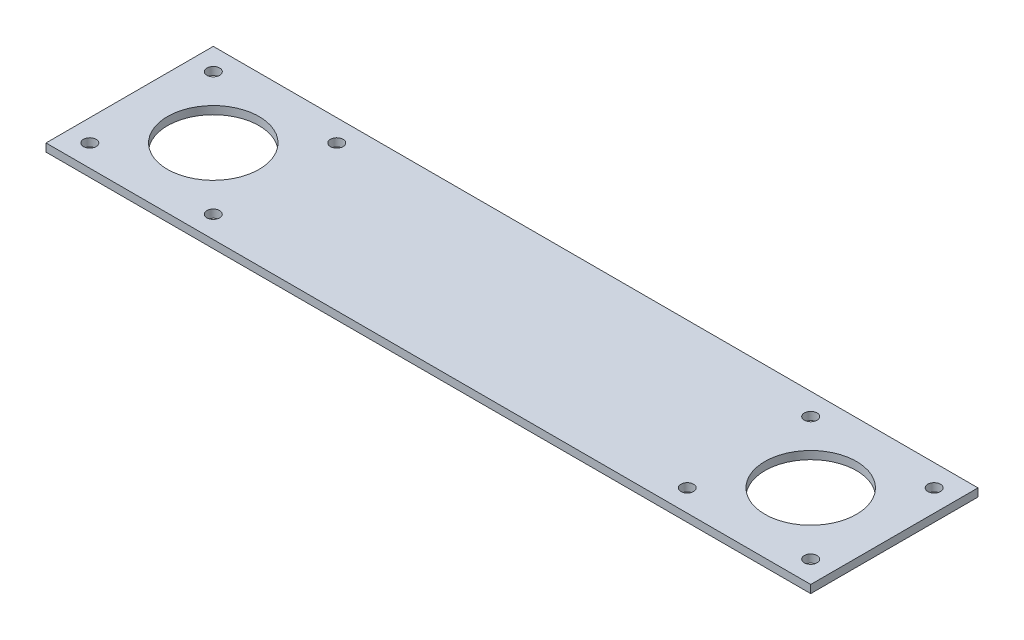
from build123d import *

# Parameters (mm, degrees)
SKETCH1_W           = 192
SKETCH1_H           = 42
SKETCH1_R           = 1.6
SKETCH1_R_2         = 11.5
BOSS_EXTRUDE1_DEPTH = 2


with BuildPart() as part:
    # Sketch1 → Boss-Extrude1 (new body)
    with BuildSketch(Plane(origin=(0, 0, 0), x_dir=(1, 0, 0), z_dir=(0, 1, 0))):
        Rectangle(SKETCH1_W, SKETCH1_H)
        with Locations(Location((-90.5, -15.5, 0), (0, 0, 270))):
            Circle(SKETCH1_R, mode=Mode.SUBTRACT)
        with Locations(Location((-59.5, -15.5, 0), (0, 0, 270))):
            Circle(SKETCH1_R, mode=Mode.SUBTRACT)
        with Locations(Location((59.5, -15.5, 0), (0, 0, 270))):
            Circle(SKETCH1_R, mode=Mode.SUBTRACT)
        with Locations(Location((90.5, -15.5, 0), (0, 0, 270))):
            Circle(SKETCH1_R, mode=Mode.SUBTRACT)
        with Locations(Location((-75, 0, 0), (0, 0, 270))):
            Circle(SKETCH1_R_2, mode=Mode.SUBTRACT)
        with Locations(Location((-90.5, 15.5, 0), (0, 0, 270))):
            Circle(SKETCH1_R, mode=Mode.SUBTRACT)
        with Locations(Location((-59.5, 15.5, 0), (0, 0, 270))):
            Circle(SKETCH1_R, mode=Mode.SUBTRACT)
        with Locations(Location((75, 0, 0), (0, 0, 270))):
            Circle(SKETCH1_R_2, mode=Mode.SUBTRACT)
        with Locations(Location((59.5, 15.5, 0), (0, 0, 270))):
            Circle(SKETCH1_R, mode=Mode.SUBTRACT)
        with Locations(Location((90.5, 15.5, 0), (0, 0, 270))):
            Circle(SKETCH1_R, mode=Mode.SUBTRACT)
    extrude(amount=BOSS_EXTRUDE1_DEPTH)


solid = part.part
